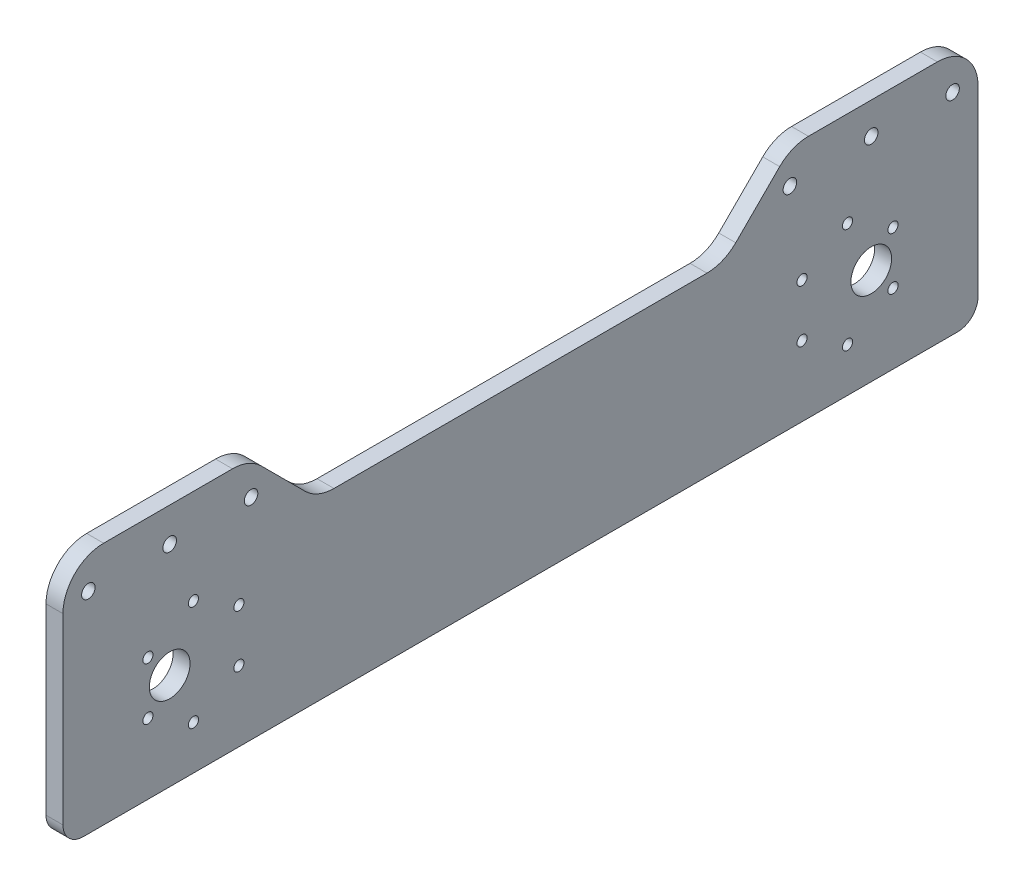
from build123d import *

# Parameters (mm, degrees)
SKETCH1_R           = 6
SKETCH1_R_2         = 2
SKETCH1_R_3         = 1.5
BOSS_EXTRUDE1_DEPTH = 5
FILLET1_R           = 6
FILLET2_R           = 12


with BuildPart() as part:
    # Sketch1 → Boss-Extrude1 (new body)
    with BuildSketch(Plane(origin=(0, 0, 0), x_dir=(0, 0, -1), z_dir=(1, 0, 0))):
        Polygon((0, 0), (55, 0), (75, -20), (195, -20), (215, 0), (270, 0), (270, -72), (0, -72), align=None)
        with Locations((31.5, -43.5)):
            Circle(SKETCH1_R, mode=Mode.SUBTRACT)
        with Locations((55.5, -10)):
            Circle(SKETCH1_R_2, mode=Mode.SUBTRACT)
        with Locations((7.5, -10)):
            Circle(SKETCH1_R_2, mode=Mode.SUBTRACT)
        with Locations((38.5, -59)):
            Circle(SKETCH1_R_3, mode=Mode.SUBTRACT)
        with Locations((25.076606241, -51.25)):
            Circle(SKETCH1_R_3, mode=Mode.SUBTRACT)
        with Locations((25.076606241, -35.75)):
            Circle(SKETCH1_R_3, mode=Mode.SUBTRACT)
        with Locations((38.5, -28)):
            Circle(SKETCH1_R_3, mode=Mode.SUBTRACT)
        with Locations((51.923393759, -35.75)):
            Circle(SKETCH1_R_3, mode=Mode.SUBTRACT)
        with Locations((51.923393759, -51.25)):
            Circle(SKETCH1_R_3, mode=Mode.SUBTRACT)
        with Locations(Location((214.5, -10, 0), (0, 0, 180))):
            Circle(SKETCH1_R_2, mode=Mode.SUBTRACT)
        with Locations(Location((238.5, -9.276470083, 0), (0, 0, 180))):
            Circle(SKETCH1_R_2, mode=Mode.SUBTRACT)
        with Locations(Location((262.5, -10, 0), (0, 0, 180))):
            Circle(SKETCH1_R_2, mode=Mode.SUBTRACT)
        with Locations(Location((244.923393759, -35.75, 0), (0, 0, 180))):
            Circle(SKETCH1_R_3, mode=Mode.SUBTRACT)
        with Locations(Location((231.5, -28, 0), (0, 0, 180))):
            Circle(SKETCH1_R_3, mode=Mode.SUBTRACT)
        with Locations(Location((218.076606241, -35.75, 0), (0, 0, 180))):
            Circle(SKETCH1_R_3, mode=Mode.SUBTRACT)
        with Locations(Location((218.076606241, -51.25, 0), (0, 0, 180))):
            Circle(SKETCH1_R_3, mode=Mode.SUBTRACT)
        with Locations(Location((231.5, -59, 0), (0, 0, 180))):
            Circle(SKETCH1_R_3, mode=Mode.SUBTRACT)
        with Locations(Location((244.923393759, -51.25, 0), (0, 0, 180))):
            Circle(SKETCH1_R_3, mode=Mode.SUBTRACT)
        with Locations(Location((238.5, -43.5, 0), (0, 0, 180))):
            Circle(SKETCH1_R, mode=Mode.SUBTRACT)
        with Locations((31.5, -10)):
            Circle(SKETCH1_R_2, mode=Mode.SUBTRACT)
    extrude(amount=BOSS_EXTRUDE1_DEPTH)

    # Fillet1
    fillet1_edges = [part.edges().sort_by_distance(p)[0] for p in [
        (2.5, -72, -270),
        (2.5, -72, 0),
    ]]
    fillet(fillet1_edges, radius=FILLET1_R)

    # Fillet2
    fillet2_edges = [part.edges().sort_by_distance(p)[0] for p in [
        (2.5, 0, 0),
        (2.5, 0, -55),
        (2.5, -20, -75),
        (2.5, -20, -195),
        (2.5, 0, -215),
        (2.5, 0, -270),
    ]]
    fillet(fillet2_edges, radius=FILLET2_R)


solid = part.part
